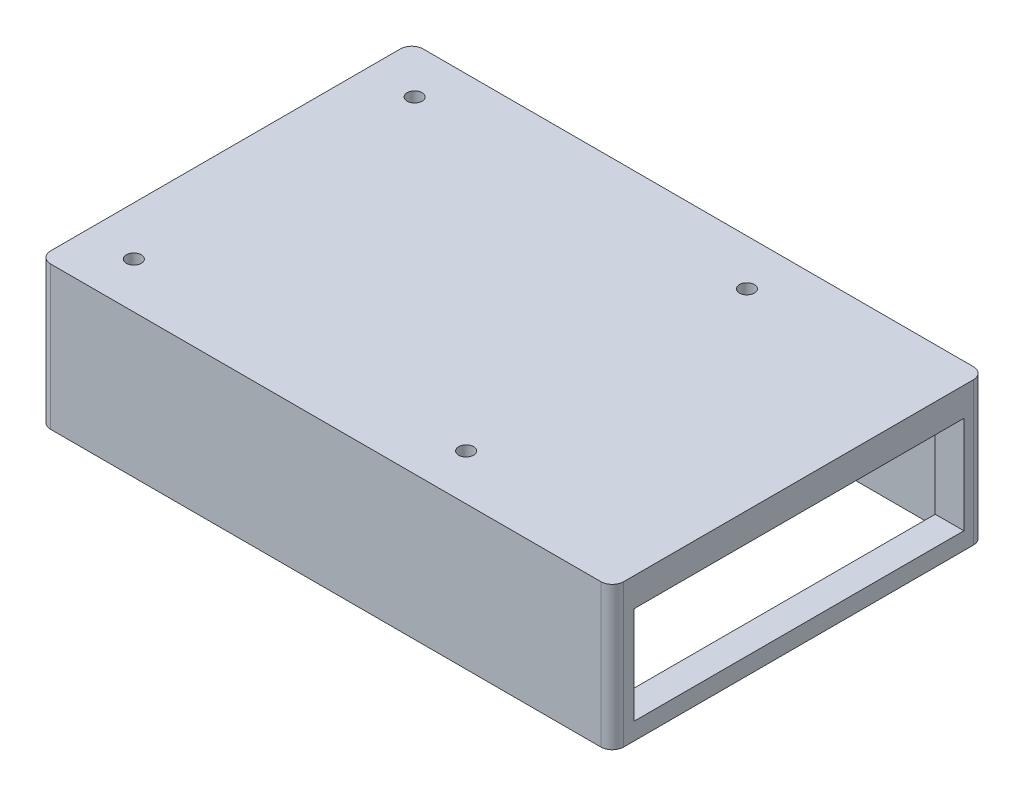
from build123d import *

# Parameters (mm, degrees)
SKETCH1_W           = 100
SKETCH1_H           = 65
BOSS_EXTRUDE2_DEPTH = 25
SKETCH1_5_W         = 90
SKETCH1_5_H         = 60
CUT_EXTRUDE1_DEPTH  = 22
SKETCH3_R           = 1.3
CUT_EXTRUDE2_DEPTH  = 18
FILLET2_R           = 2
FILLET3_R           = 2
FILLET4_R           = 2
FILLET5_R           = 2
SKETCH5_W           = 37
SKETCH5_H           = 6.720639237
CUT_EXTRUDE3_DEPTH  = 10
SKETCH6_W           = 57.574734681
SKETCH6_H           = 17
CUT_EXTRUDE4_DEPTH  = 10


with BuildPart() as part:
    # Sketch1 → Boss-Extrude2 (new body)
    with BuildSketch(Plane(origin=(0, 0, 0), x_dir=(1, 0, 0), z_dir=(0, 1, 0))):
        Rectangle(SKETCH1_W, SKETCH1_H)
    extrude(amount=BOSS_EXTRUDE2_DEPTH)

    # Sketch1<5> → Cut-Extrude1 (cut)
    with BuildSketch(Plane(origin=(0, 0, 0), x_dir=(1, 0, 0), z_dir=(0, 1, 0))):
        Rectangle(SKETCH1_5_W, SKETCH1_5_H)
    extrude(amount=CUT_EXTRUDE1_DEPTH, mode=Mode.SUBTRACT)

    # Sketch3 → Cut-Extrude2 (cut)
    with BuildSketch(Plane.XZ.offset(-22)):
        with Locations((-41.5, 24.5)):
            Circle(SKETCH3_R)
        with Locations((-41.5, -24.5)):
            Circle(SKETCH3_R)
        with Locations((16.5, -24.5)):
            Circle(SKETCH3_R)
        with Locations((16.5, 24.5)):
            Circle(SKETCH3_R)
    extrude(amount=-CUT_EXTRUDE2_DEPTH, mode=Mode.SUBTRACT)

    # Fillet2
    fillet2_edges = [part.edges().sort_by_distance(p)[0] for p in [
        (50, 12.5, 32.5),
    ]]
    fillet(fillet2_edges, radius=FILLET2_R)

    # Fillet3
    fillet3_edges = [part.edges().sort_by_distance(p)[0] for p in [
        (-50, 12.5, 32.5),
    ]]
    fillet(fillet3_edges, radius=FILLET3_R)

    # Fillet4
    fillet4_edges = [part.edges().sort_by_distance(p)[0] for p in [
        (-50, 12.5, -32.5),
    ]]
    fillet(fillet4_edges, radius=FILLET4_R)

    # Fillet5
    fillet5_edges = [part.edges().sort_by_distance(p)[0] for p in [
        (50, 12.5, -32.5),
    ]]
    fillet(fillet5_edges, radius=FILLET5_R)

    # Sketch5 → Cut-Extrude3 (cut)
    with BuildSketch(Plane(origin=(0, 0, -32.5), x_dir=(-1, 0, 0), z_dir=(0, 0, -1))):
        with Locations((20.5, 18.639680381)):
            Rectangle(SKETCH5_W, SKETCH5_H)
    extrude(amount=-CUT_EXTRUDE3_DEPTH, mode=Mode.SUBTRACT)

    # Sketch6 → Cut-Extrude4 (cut)
    with BuildSketch(Plane(origin=(50, 0, 0), x_dir=(0, 0, -1), z_dir=(1, 0, 0))):
        with Locations((0.07362498, 11.5)):
            Rectangle(SKETCH6_W, SKETCH6_H)
    extrude(amount=-CUT_EXTRUDE4_DEPTH, mode=Mode.SUBTRACT)


solid = part.part
